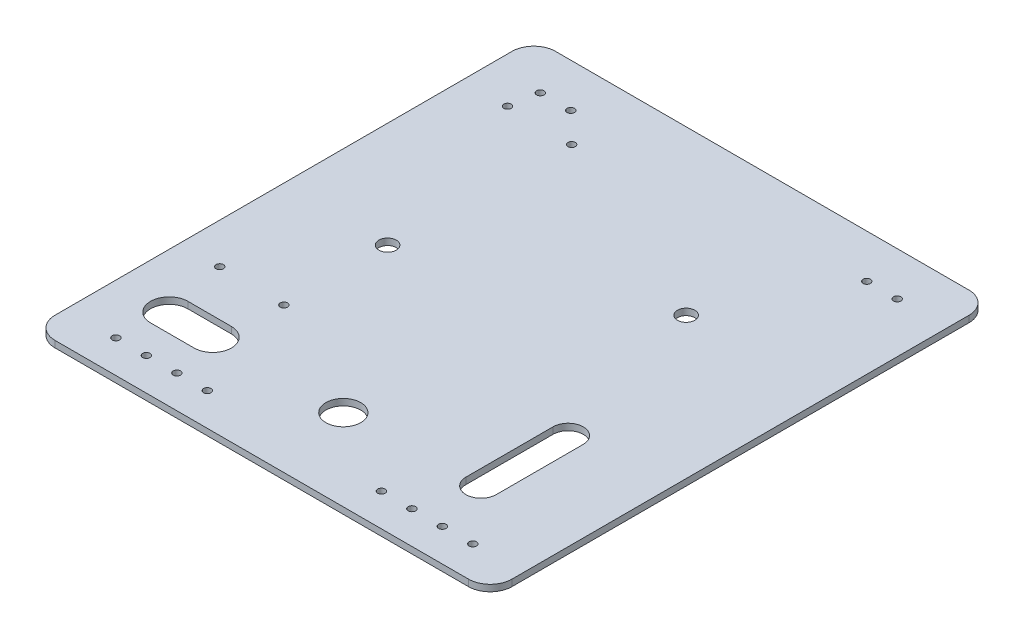
from build123d import *

# Parameters (mm, degrees)
SKETCH1_W           = 210
SKETCH1_H           = 230
BOSS_EXTRUDE1_DEPTH = 3
FILLET1_R           = 10
SKETCH2_R           = 1.7
CUT_EXTRUDE1_DEPTH  = 3
SKETCH3_R           = 4
CUT_EXTRUDE2_DEPTH  = 176.025712397
SKETCH4_R           = 8
CUT_EXTRUDE3_DEPTH  = 176.025712397
CUT_EXTRUDE4_DEPTH  = 176.025712397
SKETCH6_R           = 4
SKETCH6_R_2         = 1.7
CUT_EXTRUDE5_DEPTH  = 176.025712397


with BuildPart() as part:
    # Sketch1 → Boss-Extrude1 (new body)
    with BuildSketch(Plane(origin=(0, 0, 0), x_dir=(1, 0, 0), z_dir=(0, 1, 0))):
        with Locations((0, 25)):
            Rectangle(SKETCH1_W, SKETCH1_H)
    extrude(amount=BOSS_EXTRUDE1_DEPTH)

    # Fillet1
    fillet1_edges = [part.edges().sort_by_distance(p)[0] for p in [
        (105, 1.5, 90),
        (-105, 1.5, 90),
        (-105, 1.5, -140),
        (105, 1.5, -140),
    ]]
    fillet(fillet1_edges, radius=FILLET1_R)

    # Sketch2 → Cut-Extrude1 (cut)
    with BuildSketch(Plane(origin=(0, 3, 0), x_dir=(1, 0, 0), z_dir=(0, 1, 0))):
        with Locations(Location((-82, 120, 0), (0, 0, 270))):
            Circle(SKETCH2_R)
        with Locations(Location((-68, 120, 0), (0, 0, 270))):
            Circle(SKETCH2_R)
        with Locations(Location((68, 120, 0), (0, 0, 270))):
            Circle(SKETCH2_R)
        with Locations(Location((82, 120, 0), (0, 0, 270))):
            Circle(SKETCH2_R)
        with Locations(Location((-82, -75, 0), (0, 0, 270))):
            Circle(SKETCH2_R)
        with Locations(Location((-68, -75, 0), (0, 0, 270))):
            Circle(SKETCH2_R)
        with Locations(Location((68, -75, 0), (0, 0, 270))):
            Circle(SKETCH2_R)
        with Locations(Location((82, -75, 0), (0, 0, 270))):
            Circle(SKETCH2_R)
        with Locations(Location((-54, -75, 0), (0, 0, 270))):
            Circle(SKETCH2_R)
        with Locations(Location((54, -75, 0), (0, 0, 270))):
            Circle(SKETCH2_R)
        with Locations(Location((-40, -75, 0), (0, 0, 270))):
            Circle(SKETCH2_R)
        with Locations(Location((40, -75, 0), (0, 0, 270))):
            Circle(SKETCH2_R)
    extrude(amount=-CUT_EXTRUDE1_DEPTH, mode=Mode.SUBTRACT)

    # Sketch3 → Cut-Extrude2 (cut, through all)
    with BuildSketch(Plane(origin=(0, 3, 0), x_dir=(1, 0, 0), z_dir=(0, 1, 0))):
        with Locations(Location((40, 65, 0), (0, 0, 270))):
            Circle(SKETCH3_R)
    extrude(amount=-CUT_EXTRUDE2_DEPTH, mode=Mode.SUBTRACT)

    # Sketch4 → Cut-Extrude3 (cut, through all)
    with BuildSketch(Plane(origin=(0, 3, 0), x_dir=(1, 0, 0), z_dir=(0, 1, 0))):
        with Locations(Location((0, -52.5, 0), (0, 0, 270))):
            Circle(SKETCH4_R)
    extrude(amount=-CUT_EXTRUDE3_DEPTH, mode=Mode.SUBTRACT)

    # Sketch5 → Cut-Extrude4 (cut, through all)
    with BuildSketch(Plane(origin=(0, 3, 0), x_dir=(1, 0, 0), z_dir=(0, 1, 0))):
        with BuildLine():
            Line((67.757117203, -10), (67.757117203, -50))
            ThreePointArc((67.757117203, -50), (60.791955234, -56.965161969), (53.826793265, -50))
            Line((53.826793265, -50), (53.826793265, -10))
            ThreePointArc((53.826793265, -10), (60.791955234, -3.034838031), (67.757117203, -10))
        make_face()
        with BuildLine():
            Line((-80, -43.92126235), (-60, -43.92126235))
            ThreePointArc((-60, -43.92126235), (-51.42126235, -52.5), (-60, -61.07873765))
            Line((-60, -61.07873765), (-80, -61.07873765))
            ThreePointArc((-80, -61.07873765), (-88.57873765, -52.5), (-80, -43.92126235))
        make_face()
    extrude(amount=-CUT_EXTRUDE4_DEPTH, mode=Mode.SUBTRACT)

    # Sketch6 → Cut-Extrude5 (cut, through all)
    with BuildSketch(Plane(origin=(0, 3, 0), x_dir=(1, 0, 0), z_dir=(0, 1, 0))):
        with Locations(Location((-56.482041844, 24.314281351, 0), (0, 0, 270))):
            Circle(SKETCH6_R)
        with Locations(Location((-84.211086261, 107.143726059, 0), (0, 0, 270))):
            Circle(SKETCH6_R_2)
        with Locations(Location((-54.215528573, 106.627471285, 0), (0, 0, 270))):
            Circle(SKETCH6_R_2)
        with Locations(Location((-56.452632591, -23.353278696, 0), (0, 0, 270))):
            Circle(SKETCH6_R_2)
        with Locations(Location((-86.448190279, -22.837023922, 0), (0, 0, 270))):
            Circle(SKETCH6_R_2)
    extrude(amount=-CUT_EXTRUDE5_DEPTH, mode=Mode.SUBTRACT)


solid = part.part
